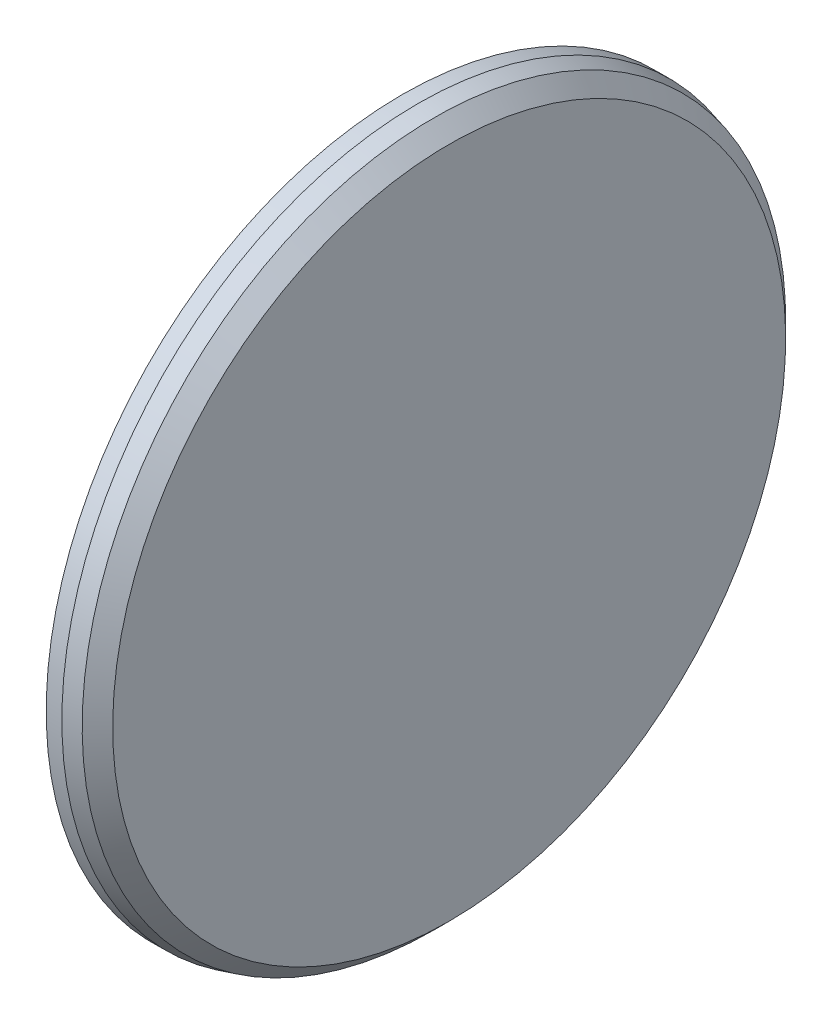
from build123d import *
from build123d.topology import SkipClean

# Parameters (mm, degrees)
CUT_EXTRUDE3_DEPTH = 10
CIRPATTERN1_COUNT  = 9


with BuildPart() as part:
    # Sketch1 → Revolve1 (revolve)
    with BuildSketch(Plane.XY, mode=Mode.PRIVATE) as revolve1_sk:
        Polygon((-40, 100), (-40, 0), (40, 0), (40, 430), (20.490381057, 449.509618943), (0, 455), (-20, 455), (-20, 410), (10, 410), (10, 100), (-20, 100), align=None)
    revolve(revolve1_sk.sketch.rotate(Axis((-40, 0, 0), (1, 0, 0)), 180), axis=Axis((-40, 0, 0), (1, 0, 0)))

    # Sketch2 → Cut-Extrude3 (cut)
    with SkipClean():  # the faces are left unmerged after this step: merging them gives an invalid solid
        with BuildSketch(Plane.ZY.offset(-10)):
            with BuildLine():
                Line((20, 105.830052443), (20, 398.873413504))
                ThreePointArc((20, 398.873413504), (23.199264746, 406.204852653), (30.75, 408.845248841))
                ThreePointArc((30.75, 408.845248841), (109.265252373, 395.172246778), (183.651957914, 366.567808672))
                ThreePointArc((183.651957914, 366.567808672), (215.530603819, 325.085308606), (202.738728221, 274.356482529))
                Line((202.738728221, 274.356482529), (51.709811994, 94.367229029))
                ThreePointArc((51.709811994, 94.367229029), (46.332346285, 91.059191807), (40.044879602, 91.631913751))
                ThreePointArc((40.044879602, 91.631913751), (33.736520206, 94.137384733), (27.272727273, 96.209138584))
                ThreePointArc((27.272727273, 96.209138584), (22.022759648, 99.799825551), (20, 105.830052443))
            make_face()
        cut_extrude3 = extrude(amount=-CUT_EXTRUDE3_DEPTH, mode=Mode.SUBTRACT)

    # CirPattern1: Cut-Extrude3 ×9 about axis
    with SkipClean():  # the faces are left unmerged after this step: merging them gives an invalid solid
        cirpattern1_axis = Axis((0, 0, 0), (1, 0, 0))
        for i in range(1, CIRPATTERN1_COUNT):
            add(cut_extrude3.rotate(cirpattern1_axis, i * 360 / CIRPATTERN1_COUNT), mode=Mode.SUBTRACT)


solid = part.part
